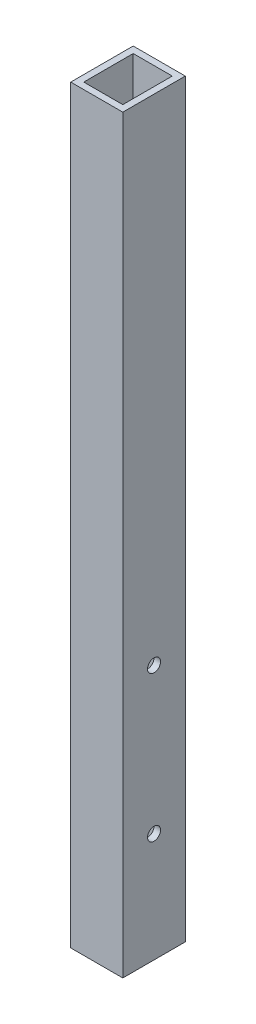
from build123d import *

# Parameters (mm, degrees)
SKETCH1_W           = 63.5
SKETCH1_H           = 76.2
BOSS_EXTRUDE1_DEPTH = 914.4
SKETCH2_W           = 47.625
SKETCH2_H           = 60.325
CUT_EXTRUDE1_DEPTH  = 916.743977594
SKETCH3_R           = 7.9375
CUT_EXTRUDE2_DEPTH  = 918.393710465


with BuildPart() as part:
    # Sketch1 → Boss-Extrude1 (new body)
    with BuildSketch(Plane(origin=(0, 0, 0), x_dir=(1, 0, 0), z_dir=(0, 1, 0))):
        Rectangle(SKETCH1_W, SKETCH1_H)
    extrude(amount=BOSS_EXTRUDE1_DEPTH)

    # Sketch2 → Cut-Extrude1 (cut, through all)
    with BuildSketch(Plane(origin=(0, 914.4, 0), x_dir=(1, 0, 0), z_dir=(0, 1, 0))):
        Rectangle(SKETCH2_W, SKETCH2_H)
    extrude(amount=-CUT_EXTRUDE1_DEPTH, mode=Mode.SUBTRACT)

    # Sketch3 → Cut-Extrude2 (cut, through all)
    with BuildSketch(Plane(origin=(31.75, 0, 0), x_dir=(0, 0, -1), z_dir=(1, 0, 0))):
        with Locations((0, 311.15)):
            Circle(SKETCH3_R)
        with Locations((0, 133.35)):
            Circle(SKETCH3_R)
    extrude(amount=-CUT_EXTRUDE2_DEPTH, mode=Mode.SUBTRACT)


solid = part.part
